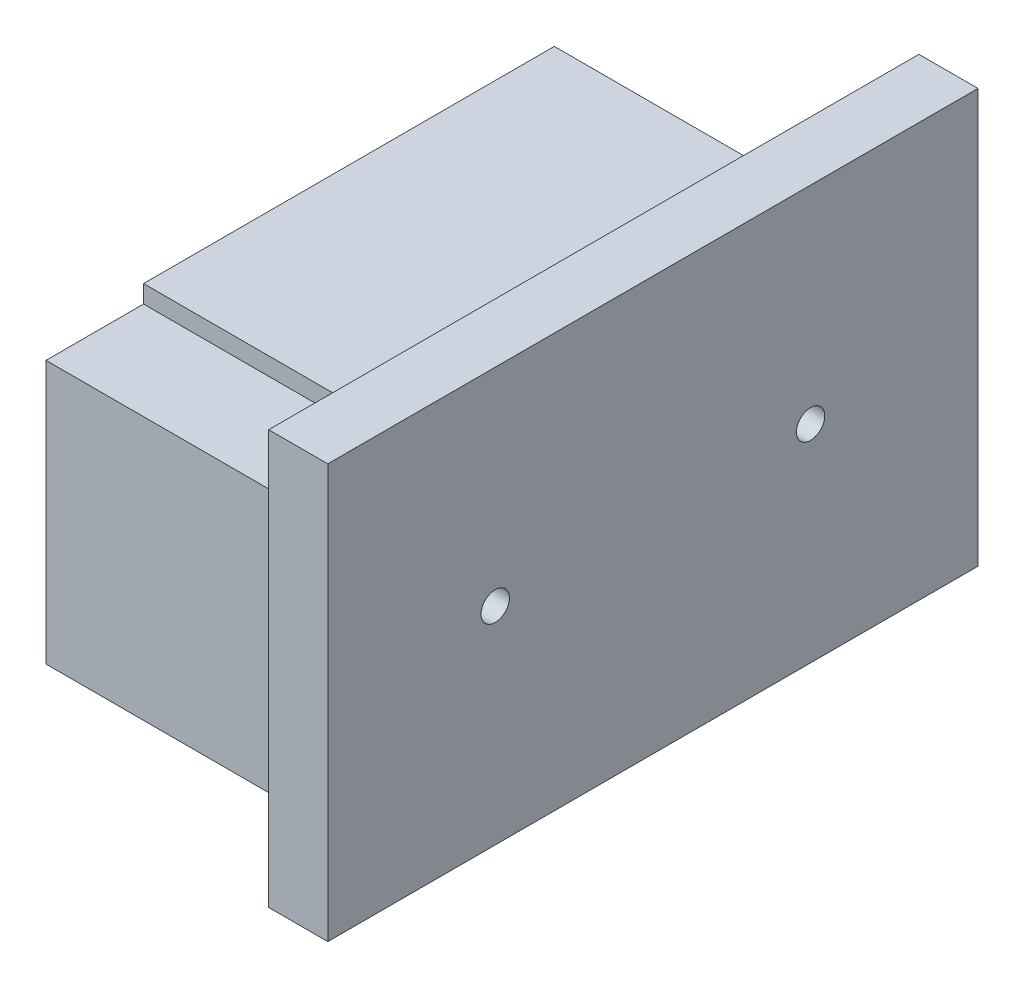
from build123d import *

# Parameters (mm, degrees)
SKETCH1_W           = 44
SKETCH1_H           = 94
BOSS_EXTRUDE1_DEPTH = 47.5
SKETCH2_R           = 19
CUT_EXTRUDE1_DEPTH  = 81.007812119
SKETCH3_W           = 8
SKETCH3_H           = 9
SKETCH3_W_2         = 16.5
SKETCH3_H_2         = 3
SKETCH3_W_3         = 2
CUT_EXTRUDE2_DEPTH  = 81.007812119
SKETCH4_W           = 110
SKETCH4_H           = 70
SKETCH4_R           = 19
BOSS_EXTRUDE2_DEPTH = 10
SKETCH5_R           = 2.4
CUT_EXTRUDE3_DEPTH  = 99.327542555


with BuildPart() as part:
    # Sketch1 → Boss-Extrude1 (new body)
    with BuildSketch(Plane(origin=(0, 0, 0), x_dir=(1, 0, 0), z_dir=(0, 1, 0))):
        Rectangle(SKETCH1_W, SKETCH1_H)
    extrude(amount=BOSS_EXTRUDE1_DEPTH)

    # Sketch2 → Cut-Extrude1 (cut, through all)
    with BuildSketch(Plane(origin=(22, 0, 0), x_dir=(0, 0, -1), z_dir=(1, 0, 0))):
        with Locations((-25, 24.5)):
            Circle(SKETCH2_R)
        with Locations((28.35, 24.5)):
            Circle(SKETCH2_R)
    extrude(amount=-CUT_EXTRUDE1_DEPTH, mode=Mode.SUBTRACT)

    # Sketch3 → Cut-Extrude2 (cut, through all)
    with BuildSketch(Plane(origin=(22, 0, 0), x_dir=(0, 0, -1), z_dir=(1, 0, 0))):
        with Locations((43, 43)):
            Rectangle(SKETCH3_W, SKETCH3_H)
        with Locations((-38.75, 46)):
            Rectangle(SKETCH3_W_2, SKETCH3_H_2)
        with Locations((46, 1.5)):
            Rectangle(SKETCH3_W_3, SKETCH3_H_2)
    extrude(amount=-CUT_EXTRUDE2_DEPTH, mode=Mode.SUBTRACT)


with BuildPart() as cut_extrude2_kept_piece:
    # of the separate pieces the step leaves, the one the design keeps (cut_extrude2_pieces_kept)
    add(part.part.solids().sort_by_distance((-22, 0, 47))[0])


with BuildPart() as body_2:
    # Sketch4 → Boss-Extrude2 (new body)
    # profile 1 of 3: a face of its own
    with BuildSketch(Plane(origin=(22, 0, 0), x_dir=(0, 0, -1), z_dir=(1, 0, 0))):
        with Locations((1.675, 24.5)):
            Rectangle(SKETCH4_W, SKETCH4_H)
        with BuildLine():
            Line((-47, 0), (45, 0))
            Line((45, 0), (45, 3))
            Line((45, 3), (47, 3))
            Line((47, 3), (47, 20.869917356))
            ThreePointArc((47, 20.869917356), (10.78952759, 17.245359504), (39, 40.234595641))
            Line((39, 40.234595641), (39, 47.5))
            Line((39, 47.5), (-30.5, 47.5))
            Line((-30.5, 47.5), (-30.5, 44.5))
            Line((-30.5, 44.5), (-47, 44.5))
            Line((-47, 44.5), (-47, 0))
        make_face(mode=Mode.SUBTRACT)
    # profile 2 of 3: a face of its own
    with BuildSketch(Plane(origin=(22, 0, 0), x_dir=(0, 0, -1), z_dir=(1, 0, 0))):
        with BuildLine():
            Line((-47, 44.5), (-47, 0))
            Line((-47, 0), (45, 0))
            Line((45, 0), (45, 3))
            Line((45, 3), (47, 3))
            Line((47, 3), (47, 20.869917356))
            ThreePointArc((47, 20.869917356), (10.78952759, 17.245359504), (39, 40.234595641))
            Line((39, 40.234595641), (39, 47.5))
            Line((39, 47.5), (-30.5, 47.5))
            Line((-30.5, 47.5), (-30.5, 44.5))
            Line((-30.5, 44.5), (-47, 44.5))
        make_face()
        with Locations((-25, 24.5)):
            Circle(SKETCH4_R, mode=Mode.SUBTRACT)
    # profile 3 of 3: a face of its own
    with BuildSketch(Plane(origin=(22, 0, 0), x_dir=(0, 0, -1), z_dir=(1, 0, 0))):
        with Locations((-25, 24.5)):
            Circle(SKETCH4_R)
    extrude(amount=BOSS_EXTRUDE2_DEPTH)

    # Sketch5 → Cut-Extrude3 (cut, through all)
    with BuildSketch(Plane(origin=(32, 0, 0), x_dir=(0, 0, -1), z_dir=(1, 0, 0))):
        with Locations((-25, 24.5)):
            Circle(SKETCH5_R)
        with Locations((28.35, 24.5)):
            Circle(SKETCH5_R)
    extrude(amount=-CUT_EXTRUDE3_DEPTH, mode=Mode.SUBTRACT)


solid = Compound([cut_extrude2_kept_piece.part, body_2.part])
